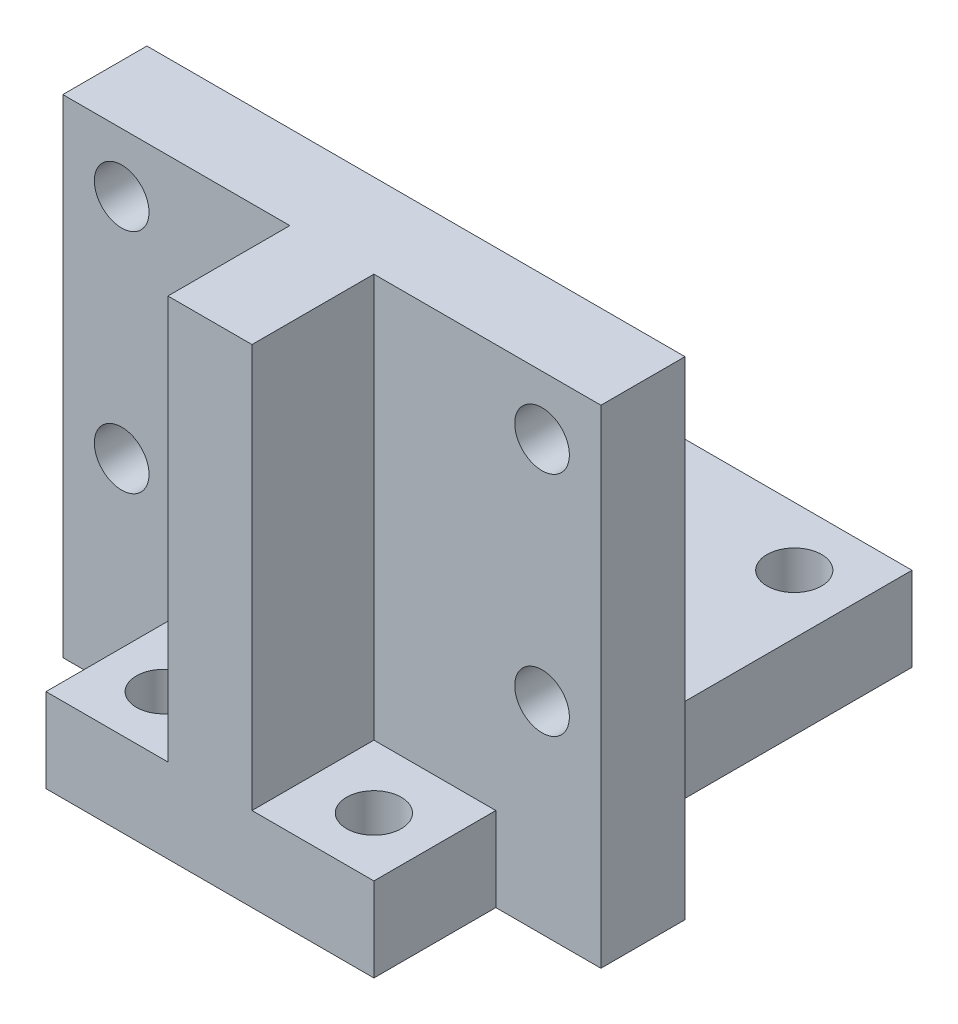
from build123d import *

# Parameters (mm, degrees)
SKETCH1_W           = 39
SKETCH1_H           = 39
SKETCH1_R           = 3.25
BOSS_EXTRUDE1_DEPTH = 10
SKETCH2_W           = 64
SKETCH2_H           = 58
SKETCH2_R           = 3.25
BOSS_EXTRUDE2_DEPTH = 5
BOSS_EXTRUDE3_REACH = 88.817
SKETCH3_W           = 10
SKETCH3_H           = 48
SKETCH5_W           = 39
SKETCH5_H           = 25
SKETCH5_R           = 3.25
BOSS_EXTRUDE4_DEPTH = 10


with BuildPart() as part:
    # Sketch1 → Boss-Extrude1 (new body)
    with BuildSketch(Plane(origin=(0, 0, 0), x_dir=(1, 0, 0), z_dir=(0, 1, 0))):
        with Locations((19.5, 19.5)):
            Rectangle(SKETCH1_W, SKETCH1_H)
        with Locations(Location((7, 32, 0), (0, 0, 270))):
            Circle(SKETCH1_R, mode=Mode.SUBTRACT)
        with Locations(Location((32, 32, 0), (0, 0, 270))):
            Circle(SKETCH1_R, mode=Mode.SUBTRACT)
        with Locations(Location((32, 7, 0), (0, 0, 270))):
            Circle(SKETCH1_R, mode=Mode.SUBTRACT)
        with Locations(Location((7, 7, 0), (0, 0, 270))):
            Circle(SKETCH1_R, mode=Mode.SUBTRACT)
    extrude(amount=BOSS_EXTRUDE1_DEPTH)

    # Sketch2 → Boss-Extrude2 (add, symmetric)
    with BuildSketch(Plane.XY.offset(-19.5)):
        with Locations((19.5, 29)):
            Rectangle(SKETCH2_W, SKETCH2_H)
        with Locations((-5.5, 51)):
            Circle(SKETCH2_R, mode=Mode.SUBTRACT)
        with Locations((44.5, 51)):
            Circle(SKETCH2_R, mode=Mode.SUBTRACT)
        with Locations((-5.5, 24)):
            Circle(SKETCH2_R, mode=Mode.SUBTRACT)
        with Locations((44.5, 24)):
            Circle(SKETCH2_R, mode=Mode.SUBTRACT)
    extrude(amount=BOSS_EXTRUDE2_DEPTH, both=True)

    # Sketch3 → Boss-Extrude3 (add, up to next)
    with BuildSketch(Plane.XY, mode=Mode.PRIVATE) as boss_extrude3_sk1:
        with Locations((19.5, 34)):
            Rectangle(SKETCH3_W, SKETCH3_H)
    boss_extrude3_tool1 = extrude(boss_extrude3_sk1.sketch, amount=-BOSS_EXTRUDE3_REACH, mode=Mode.PRIVATE) - part.part
    add(boss_extrude3_tool1.solids().sort_by_distance((19.5, 34, 0))[0])

    # Sketch5 → Boss-Extrude4 (add)
    with BuildSketch(Plane(origin=(0, 10, 0), x_dir=(1, 0, 0), z_dir=(0, 1, 0))):
        with Locations((19.5, 51.5)):
            Rectangle(SKETCH5_W, SKETCH5_H)
        with Locations(Location((7, 57, 0), (0, 0, 270))):
            Circle(SKETCH5_R, mode=Mode.SUBTRACT)
        with Locations(Location((32, 57, 0), (0, 0, 270))):
            Circle(SKETCH5_R, mode=Mode.SUBTRACT)
    extrude(amount=-BOSS_EXTRUDE4_DEPTH)


solid = part.part
